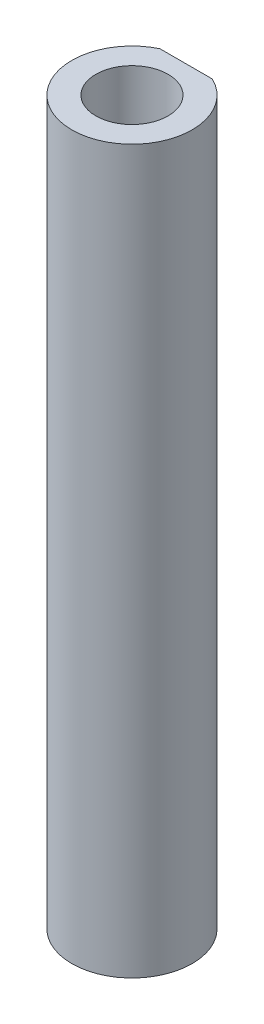
from build123d import *

# Parameters (mm, degrees)
SKETCH4_R           = 5
SKETCH4_R_2         = 3
BOSS_EXTRUDE1_DEPTH = 30
CUT_EXTRUDE1_DEPTH  = 10


with BuildPart() as part:
    # Sketch4 → Boss-Extrude1 (new, symmetric)
    with BuildSketch(Plane(origin=(0, 0, 0), x_dir=(1, 0, 0), z_dir=(0, 1, 0))):
        with Locations(Location((0, 0, 0), (0, 0, 270))):
            Circle(SKETCH4_R)
        with Locations(Location((0, 0, 0), (0, 0, 270))):
            Circle(SKETCH4_R_2, mode=Mode.SUBTRACT)
    extrude(amount=BOSS_EXTRUDE1_DEPTH, both=True)

    # Sketch10 → Cut-Extrude1 (cut)
    with BuildSketch(Plane(origin=(0, 30, 0), x_dir=(1, 0, 0), z_dir=(0, 1, 0))):
        with BuildLine():
            Line((2.179449472, 4.5), (-2.179449472, 4.5))
            ThreePointArc((-2.179449472, 4.5), (0, 5), (2.179449472, 4.5))
        make_face()
    cut_extrude1 = extrude(amount=-CUT_EXTRUDE1_DEPTH, mode=Mode.SUBTRACT)

    # Mirror2: Cut-Extrude1 across plane
    add(cut_extrude1.mirror(Plane.ZX), mode=Mode.SUBTRACT)


solid = part.part
